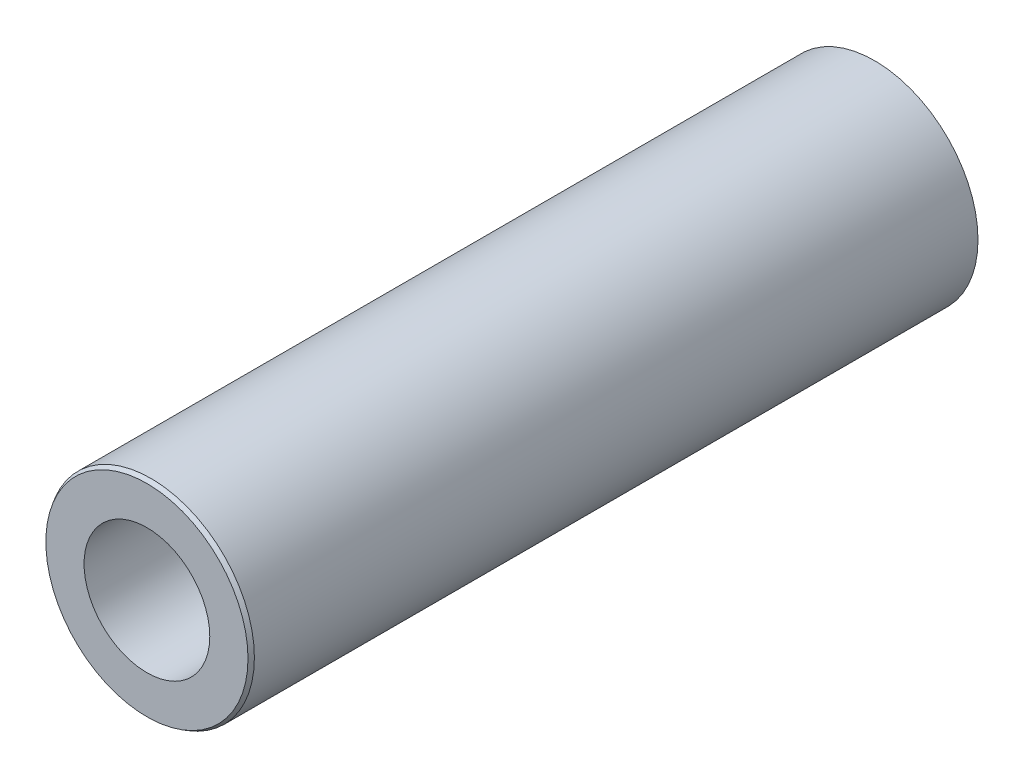
from build123d import *
from OCP.BRepFilletAPI import BRepFilletAPI_MakeChamfer

# Parameters (mm, degrees)
SKETCH1_R           = 2.55
BOSS_EXTRUDE1_DEPTH = 18
CUT_EXTRUDE1_REACH  = 41.929
SKETCH3_R           = 1.55
CHAMFER1_SIZE       = 0.1
CHAMFER1_SIZE2      = 0.057735027


with BuildPart() as part:
    # Sketch1 → Boss-Extrude1 (new body)
    with BuildSketch(Plane.XY):
        with Locations((33, 0)):
            Circle(SKETCH1_R)
    extrude(amount=BOSS_EXTRUDE1_DEPTH)

    # Sketch3 → Cut-Extrude1 (cut, up to next)
    with BuildSketch(Plane.XY.offset(18), mode=Mode.PRIVATE) as cut_extrude1_sk1:
        with Locations((33, 0)):
            Circle(SKETCH3_R)
    cut_extrude1_tool1 = extrude(cut_extrude1_sk1.sketch, amount=-CUT_EXTRUDE1_REACH, mode=Mode.PRIVATE) & part.part
    add(cut_extrude1_tool1.solids().sort_by_distance((33, 0, 18))[0], mode=Mode.SUBTRACT)

    # Chamfer1: one chamfer whose edges measure the first distance from different faces: ONE call of the kernel's chamfer builder (chamfer() names one face for all edges)
    chamfer1_edges_1 = [part.edges().sort_by_distance(p)[0] for p in [
        (30.45, 0, 0),
    ]]
    chamfer1_side_1 = [part.faces().sort_by_distance(p)[0] for p in [
        (30.522124892, 0, 0),
    ]]
    chamfer1_edges_2 = [part.edges().sort_by_distance(p)[0] for p in [
        (30.45, 0, 18),
    ]]
    chamfer1_side_2 = [part.faces().sort_by_distance(p)[0] for p in [
        (30.45, 0, 9),
    ]]
    chamfer1 = BRepFilletAPI_MakeChamfer(part.part.solid().wrapped)
    for e in chamfer1_edges_1:
        chamfer1.Add(CHAMFER1_SIZE, CHAMFER1_SIZE2, e.wrapped, chamfer1_side_1[0].wrapped)  # the first distance lies on this face
    for e in chamfer1_edges_2:
        chamfer1.Add(CHAMFER1_SIZE, CHAMFER1_SIZE2, e.wrapped, chamfer1_side_2[0].wrapped)  # the first distance lies on this face
    add(Compound.cast(chamfer1.Shape()), mode=Mode.REPLACE)


solid = part.part
